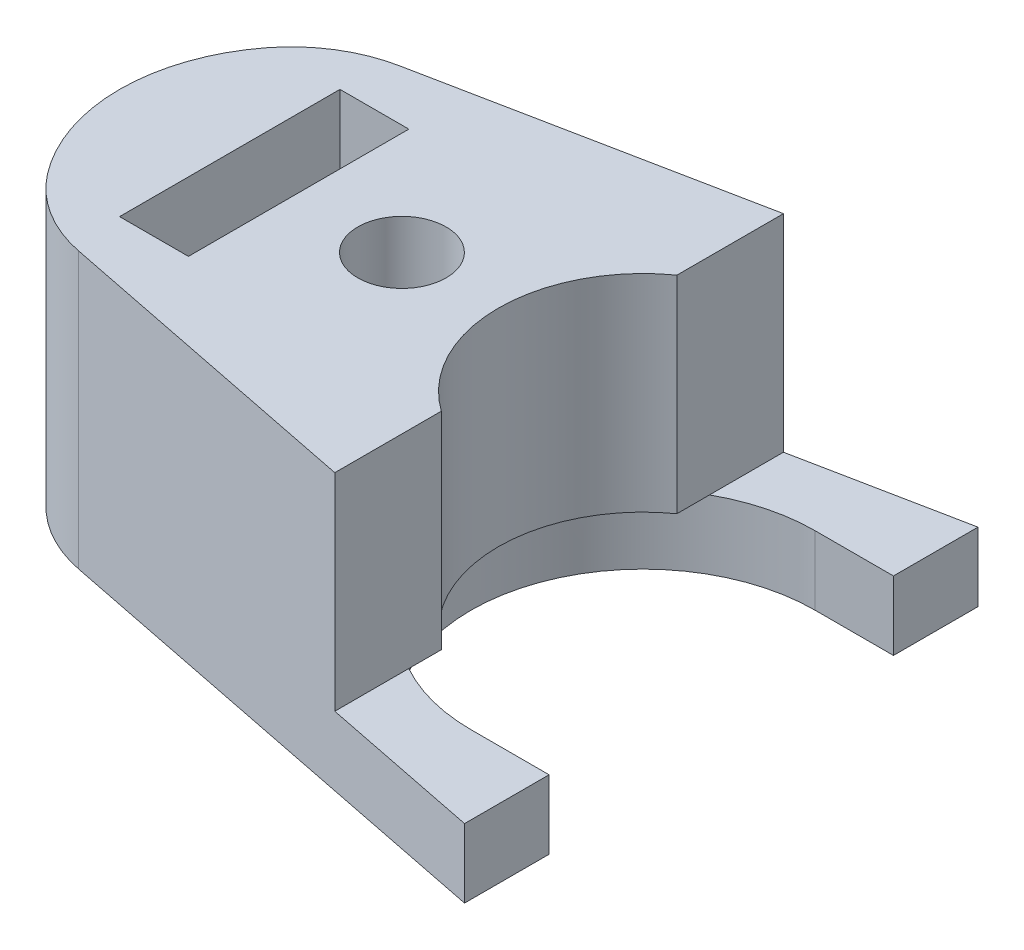
from build123d import *

# Parameters (mm, degrees)
SKETCH1_R           = 0.3207
SKETCH1_W           = 0.5
SKETCH1_H           = 1.6
BOSS_EXTRUDE2_DEPTH = 0.5
BOSS_EXTRUDE3_START = 0.5
SKETCH1_28_W        = 0.5
SKETCH1_28_H        = 1.6
SKETCH1_28_R        = 0.3207
BOSS_EXTRUDE3_DEPTH = 1.5


with BuildPart() as part:
    # Sketch1 → Boss-Extrude2 (new body)
    with BuildSketch(Plane(origin=(0, 0, 0), x_dir=(1, 0, 0), z_dir=(0, 1, 0))):
        with BuildLine():
            Line((-0.68194188, 1.25), (-0.68194188, 1.863743198))
            Line((-0.68194188, 1.863743198), (-4.183235691, 1.164159972))
            ThreePointArc((-4.183235691, 1.164159972), (-4.514100233, 1.033532974), (-4.778306422, 0.795352691))
            ThreePointArc((-4.778306422, 0.795352691), (-5.05, -2e-09), (-4.778306419, -0.795352694))
            ThreePointArc((-4.778306419, -0.795352694), (-4.514100231, -1.033532975), (-4.183235691, -1.164159973))
            Line((-4.183235691, -1.164159973), (-0.68194188, -1.863743197))
            Line((-0.68194188, -1.863743197), (-0.68194188, -1.25))
            Line((-0.68194188, -1.25), (-1.25, -1.25))
            ThreePointArc((-1.25, -1.25), (-2.5, 0), (-1.25, 1.25))
            Line((-1.25, 1.25), (-0.68194188, 1.25))
        make_face()
        with Locations((-3, 0)):
            Circle(SKETCH1_R, mode=Mode.SUBTRACT)
        with Locations((-4, 0)):
            Rectangle(SKETCH1_W, SKETCH1_H, mode=Mode.SUBTRACT)
    extrude(amount=BOSS_EXTRUDE2_DEPTH)

    # Sketch1<28> → Boss-Extrude3 (add)
    with BuildSketch(Plane(origin=(0, 0, 0), x_dir=(1, 0, 0), z_dir=(0, 1, 0)).offset(BOSS_EXTRUDE3_START)):
        with BuildLine():
            Line((-1.85903885, 1.628550912), (-4.183235691, 1.164159972))
            ThreePointArc((-4.183235691, 1.164159972), (-4.514100233, 1.033532974), (-4.778306422, 0.795352691))
            ThreePointArc((-4.778306422, 0.795352691), (-5.05, -2e-09), (-4.778306419, -0.795352694))
            ThreePointArc((-4.778306419, -0.795352694), (-4.514100231, -1.033532975), (-4.183235691, -1.164159973))
            Line((-4.183235691, -1.164159973), (-1.85903885, -1.628550912))
            Line((-1.85903885, -1.628550912), (-1.85903885, -0.855319636))
            ThreePointArc((-1.85903885, -0.855319636), (-2.3, 0), (-1.85903885, 0.855319636))
            Line((-1.85903885, 0.855319636), (-1.85903885, 1.628550912))
        make_face()
        with Locations((-4, 0)):
            Rectangle(SKETCH1_28_W, SKETCH1_28_H, mode=Mode.SUBTRACT)
        with Locations((-3, 0)):
            Circle(SKETCH1_28_R, mode=Mode.SUBTRACT)
    extrude(amount=BOSS_EXTRUDE3_DEPTH)


solid = part.part
